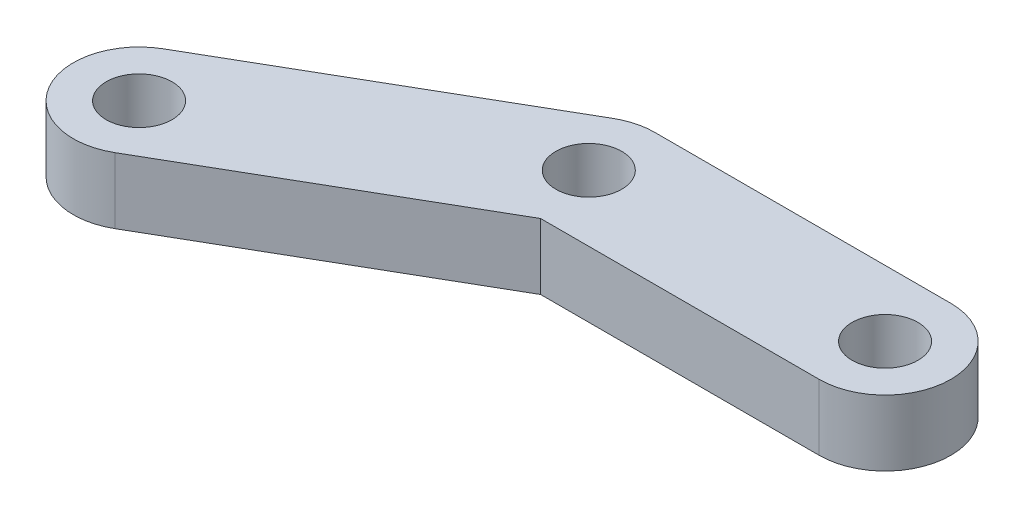
from build123d import *

# Parameters (mm, degrees)
SKETCH1_R           = 2.5
BOSS_EXTRUDE1_DEPTH = 5
BOSS_EXTRUDE2_START = -5
SKETCH2_R           = 2.5
BOSS_EXTRUDE2_DEPTH = 5


with BuildPart() as part:
    # Sketch1 → Boss-Extrude1 (new body)
    with BuildSketch(Plane(origin=(0, 0, 0), x_dir=(1, 0, 0), z_dir=(0, 1, 0))):
        with BuildLine():
            Line((0, 5), (22.5, 5))
            ThreePointArc((22.5, 5), (27.5, 0), (22.5, -5))
            Line((22.5, -5), (0, -5))
            ThreePointArc((0, -5), (-5, 0), (0, 5))
        make_face()
        with Locations(Location((0, 0, 0), (0, 0, 270))):
            Circle(SKETCH1_R, mode=Mode.SUBTRACT)
        with Locations(Location((22.5, 0, 0), (0, 0, 270))):
            Circle(SKETCH1_R, mode=Mode.SUBTRACT)
    extrude(amount=BOSS_EXTRUDE1_DEPTH)

    # Sketch2 → Boss-Extrude2 (add)
    with BuildSketch(Plane(origin=(0, 5, 0), x_dir=(1, 0, 0), z_dir=(0, 1, 0)).offset(BOSS_EXTRUDE2_START)):
        with BuildLine():
            Line((2.5, -4.330127019), (-19.150635095, -16.830127019))
            ThreePointArc((-19.150635095, -16.830127019), (-25.980762114, -15), (-24.150635095, -8.169872981))
            Line((-24.150635095, -8.169872981), (-2.5, 4.330127019))
            ThreePointArc((-2.5, 4.330127019), (4.330127019, 2.5), (2.5, -4.330127019))
        make_face()
        with Locations(Location((-21.650635095, -12.5, 0), (0, 0, 270))):
            Circle(SKETCH2_R, mode=Mode.SUBTRACT)
        with Locations(Location((0, 0, 0), (0, 0, 270))):
            Circle(SKETCH2_R, mode=Mode.SUBTRACT)
    extrude(amount=BOSS_EXTRUDE2_DEPTH)


solid = part.part
